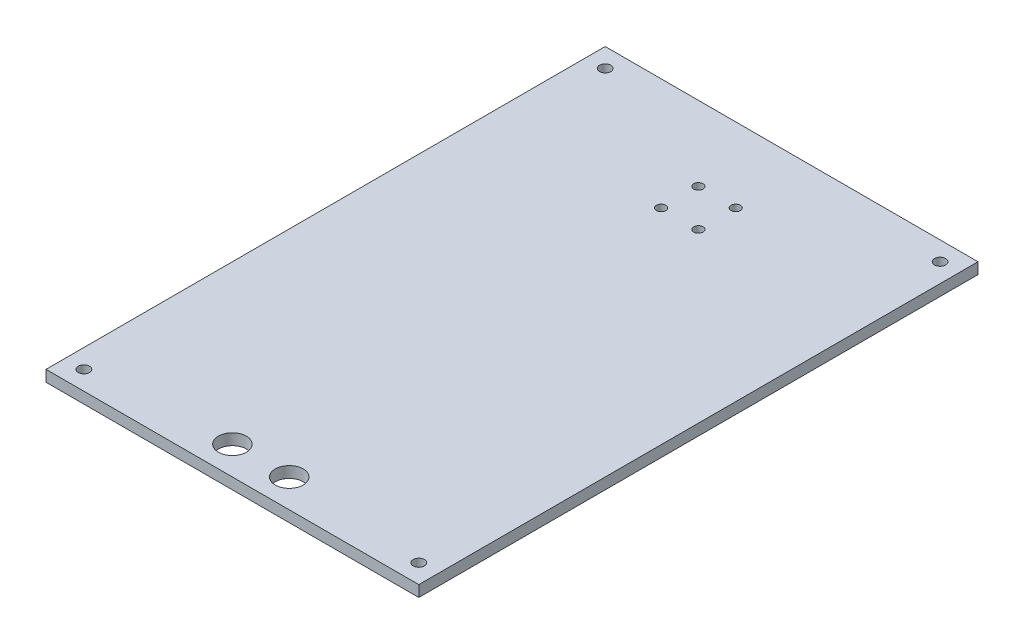
from build123d import *

# Parameters (mm, degrees)
SKETCH1_W           = 99.999999898
SKETCH1_H           = 149.999999974
BOSS_EXTRUDE1_DEPTH = 3
SKETCH2_R           = 3.749999993
SKETCH2_R_2         = 1.500000048
SKETCH2_R_3         = 1.5
SKETCH2_R_4         = 1.25
CUT_EXTRUDE1_DEPTH  = 3


with BuildPart() as part:
    # Sketch1 → Boss-Extrude1 (new body)
    with BuildSketch(Plane(origin=(0, 0, 0), x_dir=(1, 0, 0), z_dir=(0, 1, 0))):
        Rectangle(SKETCH1_W, SKETCH1_H)
    extrude(amount=BOSS_EXTRUDE1_DEPTH)

    # Sketch2 → Cut-Extrude1 (cut)
    with BuildSketch(Plane(origin=(0, 3, 0), x_dir=(1, 0, 0), z_dir=(0, 1, 0))):
        with Locations(Location((-7.62, -67.379999987, 0), (0, 0, 270))):
            Circle(SKETCH2_R)
        with Locations(Location((7.62, -67.379999987, 0), (0, 0, 270))):
            Circle(SKETCH2_R)
        with Locations(Location((-44.919999949, 69.919999987, 0), (0, 0, 270))):
            Circle(SKETCH2_R_2)
        with Locations(Location((44.919999949, 69.919999987, 0), (0, 0, 270))):
            Circle(SKETCH2_R_3)
        with Locations(Location((-44.919999949, -69.919999987, 0), (0, 0, 270))):
            Circle(SKETCH2_R_3)
        with Locations(Location((44.919999949, -69.919999987, 0), (0, 0, 270))):
            Circle(SKETCH2_R_3)
        with Locations(Location((-4.999999906, 55.000000109, 0), (0, 0, 270))):
            Circle(SKETCH2_R_4)
        with Locations(Location((4.999999906, 55.000000109, 0), (0, 0, 270))):
            Circle(SKETCH2_R_4)
        with Locations(Location((-4.999999906, 45.000000109, 0), (0, 0, 270))):
            Circle(SKETCH2_R_4)
        with Locations(Location((4.999999906, 45.000000109, 0), (0, 0, 270))):
            Circle(SKETCH2_R_4)
    extrude(amount=-CUT_EXTRUDE1_DEPTH, mode=Mode.SUBTRACT)


solid = part.part
